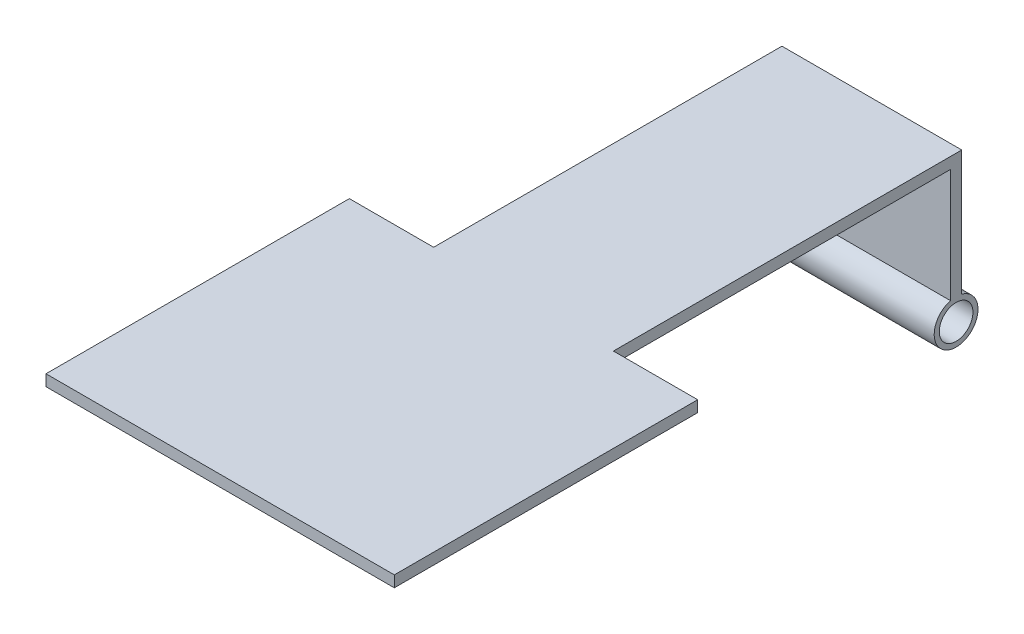
from build123d import *

# Parameters (mm, degrees)
SKETCH1_R           = 1.5
BOSS_EXTRUDE1_DEPTH = 16
BOSS_EXTRUDE2_DEPTH = 1


with BuildPart() as part:
    # Sketch1 → Boss-Extrude1 (new body)
    with BuildSketch(Plane(origin=(0, 0, 0), x_dir=(0, 0, -1), z_dir=(1, 0, 0))):
        with BuildLine():
            Line((0.49946551, 12.999886025), (-0.50053449, 12.999886025))
            Line((-0.50053449, 12.999886025), (-0.50053449, 1.884665812))
            ThreePointArc((-0.50053449, 1.884665812), (0.000552977, -1.949999922), (0.49946551, 1.88494939))
            Line((0.49946551, 1.88494939), (0.49946551, 12.999886025))
        make_face()
        Circle(SKETCH1_R, mode=Mode.SUBTRACT)
    extrude(amount=BOSS_EXTRUDE1_DEPTH)

    # Sketch2 → Boss-Extrude2 (add)
    with BuildSketch(Plane(origin=(0, 12.999886025, 0), x_dir=(1, 0, 0), z_dir=(0, 1, 0))):
        Polygon((16, -0.50053449), (0, -0.50053449), (0, -30.50053449), (-7.5, -30.50053449), (-7.5, -57.5), (23.5, -57.5), (23.5, -30.50053449), (16, -30.50053449), align=None)
    extrude(amount=-BOSS_EXTRUDE2_DEPTH)


solid = part.part
